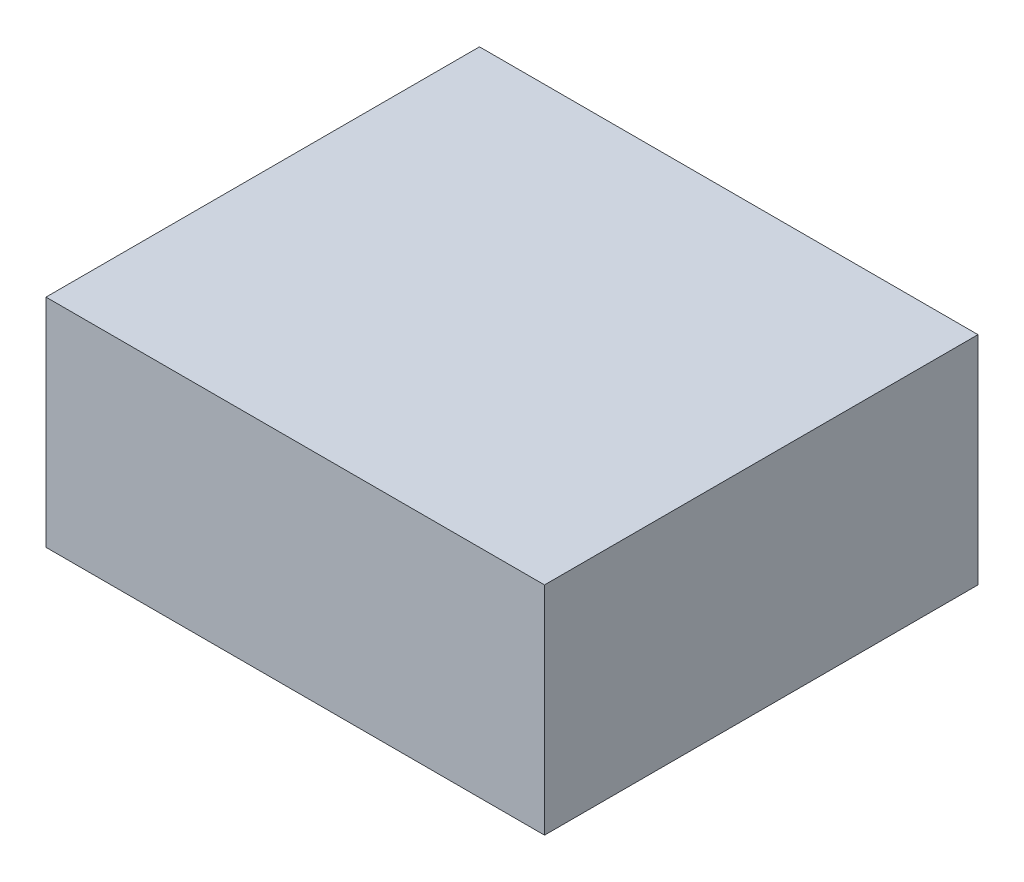
from build123d import *

# Parameters (mm, degrees)
SKETCH1_W           = 23
SKETCH1_H           = 20
BOSS_EXTRUDE1_DEPTH = 10


with BuildPart() as part:
    # Sketch1 → Boss-Extrude1 (new body)
    with BuildSketch(Plane(origin=(0, 0, 0), x_dir=(1, 0, 0), z_dir=(0, 1, 0))):
        with Locations((11.5, 10)):
            Rectangle(SKETCH1_W, SKETCH1_H)
    extrude(amount=-BOSS_EXTRUDE1_DEPTH)


solid = part.part
